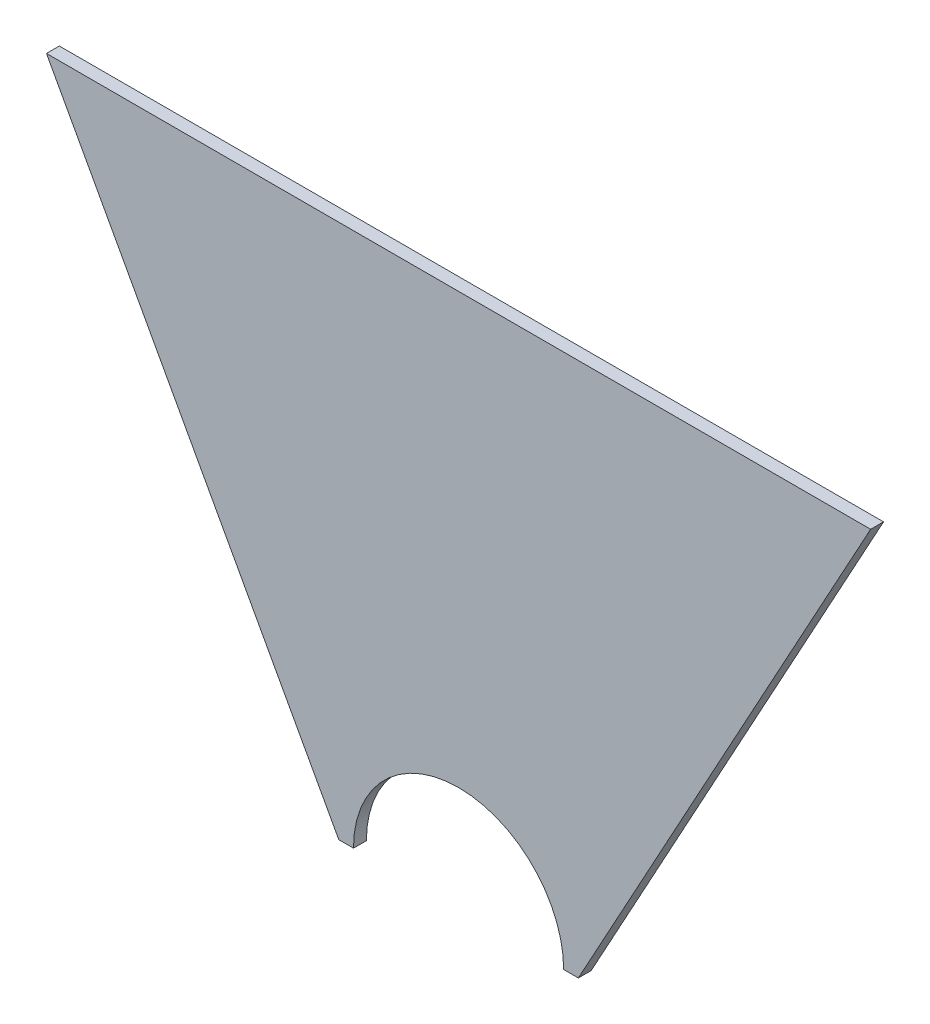
from build123d import *

# Parameters (mm, degrees)
BOSS_EXTRUDE1_DEPTH = 1.5875


with BuildPart() as part:
    # Sketch1 → Boss-Extrude1 (new body)
    with BuildSketch(Plane.XY):
        with BuildLine():
            Line((12.954, 0), (14.763217877, 0))
            Line((14.763217877, 0), (50.8, 65.921889011))
            Line((50.8, 65.921889011), (-50.8, 65.921889011))
            Line((-50.8, 65.921889011), (-14.763217877, 0))
            Line((-14.763217877, 0), (-12.954, 0))
            ThreePointArc((-12.954, 0), (0, 12.954), (12.954, 0))
        make_face()
    extrude(amount=BOSS_EXTRUDE1_DEPTH)


solid = part.part
